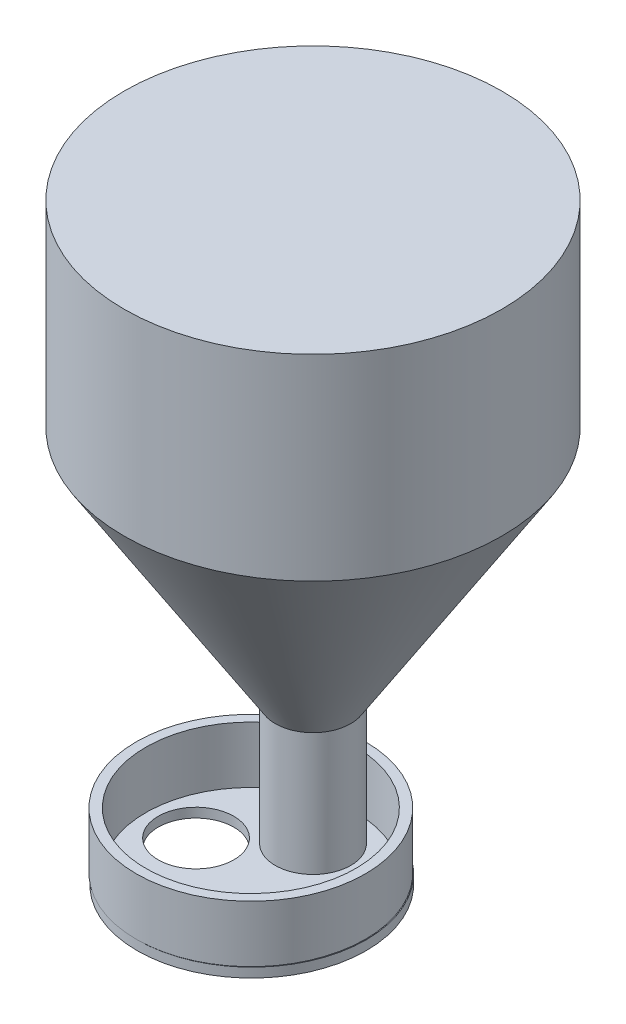
from build123d import *

# Parameters (mm, degrees)
CROQUIS1_R              = 100
SALIENTE_EXTRUIR1_DEPTH = 104
CROQUIS3_R              = 20
CROQUIS2_R              = 100
CROQUIS4_R              = 20
SALIENTE_EXTRUIR2_DEPTH = 65
CROQUIS7_R              = 17.5
CORTAR_EXTRUIR2_DEPTH   = 24
CROQUIS8_R              = 60.602826114
CROQUIS8_R_2            = 55.602826114
SALIENTE_EXTRUIR3_DEPTH = 30
CROQUIS10_R             = 60.602826114
CROQUIS10_R_2           = 20
SALIENTE_EXTRUIR5_DEPTH = 5


with BuildPart() as part:
    # Croquis1 → Saliente-Extruir1 (new body)
    with BuildSketch(Plane(origin=(0, 0, 0), x_dir=(1, 0, 0), z_dir=(0, 1, 0))):
        with Locations(Location((0, 0, 0), (0, 0, 270))):
            Circle(CROQUIS1_R)
    extrude(amount=-SALIENTE_EXTRUIR1_DEPTH)

    # Croquis3 → Recubrir1 section 0
    with BuildSketch(Plane(origin=(0, -230, 0), x_dir=(1, 0, 0), z_dir=(0, 1, 0))):
        Circle(CROQUIS3_R)
    # Croquis2 → Recubrir1 section 1
    with BuildSketch(Plane.XZ.offset(104)):
        Circle(CROQUIS2_R)
    loft()

    # Croquis4 → Saliente-Extruir2 (add)
    with BuildSketch(Plane.XZ.offset(230)):
        with Locations(Location((0, 0, 0), (0, 0, 270))):
            Circle(CROQUIS4_R)
    extrude(amount=SALIENTE_EXTRUIR2_DEPTH)

    # Croquis7 → Cortar-Extruir2 (cut)
    with BuildSketch(Plane.XZ.offset(295)):
        with Locations(Location((0, 0, 0), (0, 0, 270))):
            Circle(CROQUIS7_R)
    extrude(amount=-CORTAR_EXTRUIR2_DEPTH, mode=Mode.SUBTRACT)


with BuildPart() as body_2:
    # Croquis8 → Saliente-Extruir3 (new body)
    with BuildSketch(Plane.XZ.offset(295)):
        with Locations(Location((-32.893475565, 0, 0), (0, 0, 270))):
            Circle(CROQUIS8_R)
        with Locations(Location((-32.893475565, 0, 0), (0, 0, 270))):
            Circle(CROQUIS8_R_2, mode=Mode.SUBTRACT)
    extrude(amount=SALIENTE_EXTRUIR3_DEPTH)

    # Croquis10 → Saliente-Extruir5 (add)
    with BuildSketch(Plane.XZ.offset(325)):
        with Locations(Location((-32.443615628, 0, 0), (0, 0, 90.212656212))):
            Circle(CROQUIS10_R)
        with Locations(Location((-63.53778642, -1.617860302, 0), (0, 0, 270))):
            Circle(CROQUIS10_R_2, mode=Mode.SUBTRACT)
    extrude(amount=SALIENTE_EXTRUIR5_DEPTH)


solid = Compound([part.part, body_2.part])
